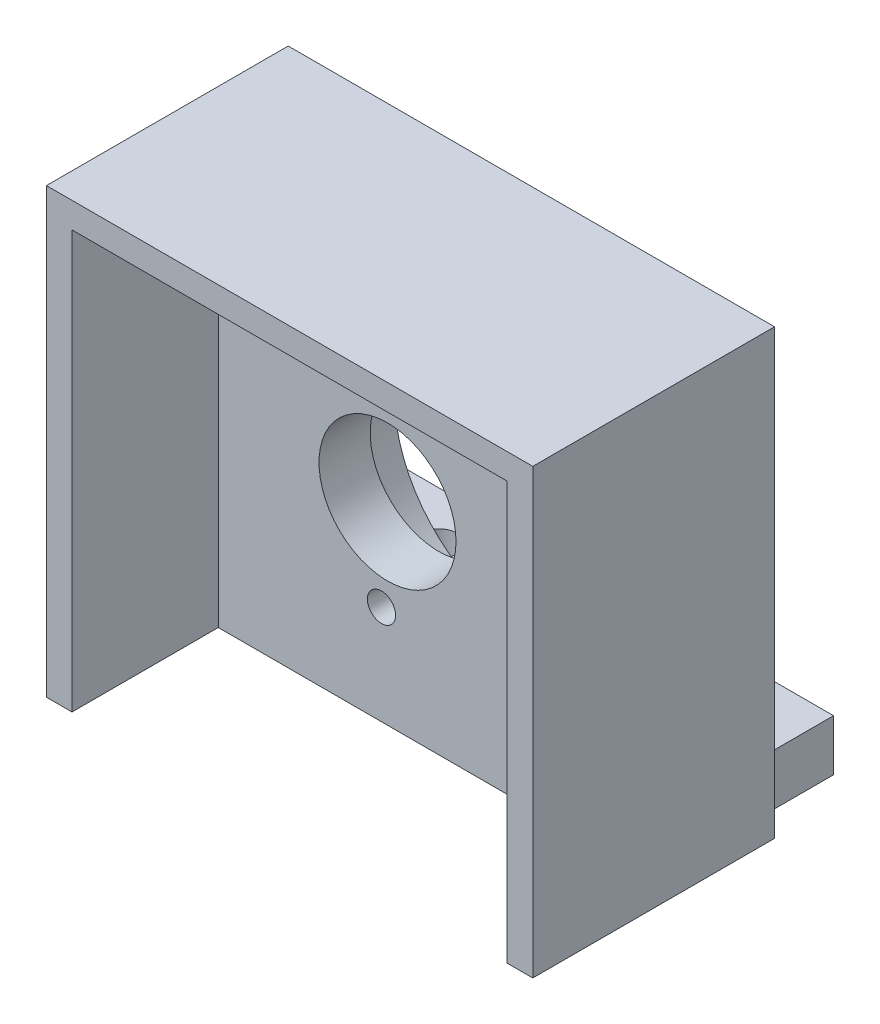
from build123d import *

# Parameters (mm, degrees)
SKETCH1_W            = 48
SKETCH1_H            = 48
SKETCH1_R            = 1.75
SKETCH1_R_2          = 8.5
BOSS_EXTRUDE2_DEPTH  = 3.175
SKETCH2_W            = 14
SKETCH2_H            = 6.35
BOSS_EXTRUDE3_DEPTH  = 48
SKETCH3_W            = 48
SKETCH3_H            = 48
SKETCH3_R            = 17
BOSS_EXTRUDE4_DEPTH  = 5.499999938
M4_CLEARANCE_HOLE1_D = 4.5
SKETCH7_W            = 48
SKETCH7_H            = 6.35
BOSS_EXTRUDE5_DEPTH  = 2
BOSS_EXTRUDE6_DEPTH  = 3
SKETCH12_W           = 54
SKETCH12_H           = 48
CUT_EXTRUDE4_DEPTH   = 16
SKETCH15_W           = 3.175
SKETCH15_H           = 41.65
SKETCH15_H_2         = 3.175
SKETCH15_W_2         = 54
BOSS_EXTRUDE8_DEPTH  = 30
SKETCH16_W           = 54
SKETCH16_H           = 3.175
CUT_EXTRUDE5_DEPTH   = 45.565155952
SKETCH17_W           = 60.35
SKETCH17_H           = 30
BOSS_EXTRUDE9_DEPTH  = 10.16
SKETCH18_W           = 54
SKETCH18_H           = 10.16
CUT_EXTRUDE6_DEPTH   = 18.150000062


with BuildPart() as part:
    # Sketch1 → Boss-Extrude2 (new, symmetric)
    with BuildSketch(Plane.XY):
        Rectangle(SKETCH1_W, SKETCH1_H)
        with Locations((13.5, 0)):
            Circle(SKETCH1_R, mode=Mode.SUBTRACT)
        with Locations((-6.75, 11.691342951)):
            Circle(SKETCH1_R, mode=Mode.SUBTRACT)
        with Locations((-6.75, -11.691342951)):
            Circle(SKETCH1_R, mode=Mode.SUBTRACT)
        with Locations((-6, 0)):
            Circle(SKETCH1_R_2, mode=Mode.SUBTRACT)
    extrude(amount=BOSS_EXTRUDE2_DEPTH, both=True)

    # Sketch2 → Boss-Extrude3 (add)
    with BuildSketch(Plane(origin=(24, 0, 0), x_dir=(0, 0, -1), z_dir=(1, 0, 0))):
        with Locations((10.175, -20.825)):
            Rectangle(SKETCH2_W, SKETCH2_H)
    boss_extrude3 = extrude(amount=-BOSS_EXTRUDE3_DEPTH)

    # Sketch3 → Boss-Extrude4 (add)
    with BuildSketch(Plane.XY.offset(3.175)):
        Rectangle(SKETCH3_W, SKETCH3_H)
        Circle(SKETCH3_R, mode=Mode.SUBTRACT)
    boss_extrude4 = extrude(amount=BOSS_EXTRUDE4_DEPTH)

    # Mirror1: Boss-Extrude3, Boss-Extrude4 across plane
    add(boss_extrude3.mirror(Plane.XY))
    add(boss_extrude4.mirror(Plane.XY))

    # M4 Clearance Hole1 (through all)
    with Locations(Plane(origin=(0, -17.65, 0), x_dir=(1, 0, 0), z_dir=(0, 1, 0))):
        with Locations((-16, -13.175), (16, -13.175), (16, 13.175), (-16, 13.175)):
            Hole(M4_CLEARANCE_HOLE1_D / 2)

    # Sketch7 → Boss-Extrude5 (add)
    with BuildSketch(Plane.XY.offset(17.175)):
        with Locations((0, -20.825)):
            Rectangle(SKETCH7_W, SKETCH7_H)
    boss_extrude5 = extrude(amount=BOSS_EXTRUDE5_DEPTH)

    # Mirror2: Boss-Extrude5 across plane
    add(boss_extrude5.mirror(Plane.XY))

    # Sketch8 → Boss-Extrude6 (add)
    with BuildSketch(Plane.ZY.offset(24)):
        Polygon((-19.175, -17.65), (-19.175, -24), (19.175, -24), (19.175, -17.65), (8.674999938, -17.65), (8.674999938, 24), (-8.674999938, 24), (-8.674999938, -17.65), align=None)
    boss_extrude6 = extrude(amount=BOSS_EXTRUDE6_DEPTH)

    # Mirror3: Boss-Extrude6 across plane
    add(boss_extrude6.mirror(Plane(origin=(0, 0, 0), x_dir=(0, 0, 1), z_dir=(1, 0, 0))))

    # Sketch12 → Cut-Extrude4 (cut)
    with BuildSketch(Plane.XY.offset(19.175)):
        Rectangle(SKETCH12_W, SKETCH12_H)
    extrude(amount=-CUT_EXTRUDE4_DEPTH, mode=Mode.SUBTRACT)

    # Sketch15 → Boss-Extrude8 (add)
    with BuildSketch(Plane(origin=(0, 0, -8.674999938), x_dir=(-1, 0, 0), z_dir=(0, 0, -1))):
        Polygon((27, -24), (30.175, -24), (30.175, 17.65), (27, 17.65), (27, -17.65), align=None)
        with Locations((-28.5875, -3.175)):
            Rectangle(SKETCH15_W, SKETCH15_H)
        with Locations((-28.5875, 19.2375)):
            Rectangle(SKETCH15_W, SKETCH15_H_2)
        with Locations((0, 19.2375)):
            Rectangle(SKETCH15_W_2, SKETCH15_H_2)
        with Locations((28.5875, 19.2375)):
            Rectangle(SKETCH15_W, SKETCH15_H_2)
    extrude(amount=-BOSS_EXTRUDE8_DEPTH)

    # Sketch16 → Cut-Extrude5 (cut, through all)
    with BuildSketch(Plane.XY.offset(3.175)):
        with Locations((0, 22.4125)):
            Rectangle(SKETCH16_W, SKETCH16_H)
    extrude(amount=-CUT_EXTRUDE5_DEPTH, mode=Mode.SUBTRACT)

    # Sketch17 → Boss-Extrude9 (add)
    with BuildSketch(Plane(origin=(0, 20.825, 0), x_dir=(1, 0, 0), z_dir=(0, 1, 0))):
        with Locations((0, -6.325000062)):
            Rectangle(SKETCH17_W, SKETCH17_H)
    extrude(amount=BOSS_EXTRUDE9_DEPTH)

    # Sketch18 → Cut-Extrude6 (cut)
    with BuildSketch(Plane.XY.offset(21.325000062)):
        with Locations((0, 22.73)):
            Rectangle(SKETCH18_W, SKETCH18_H)
    extrude(amount=-CUT_EXTRUDE6_DEPTH, mode=Mode.SUBTRACT)


solid = part.part
